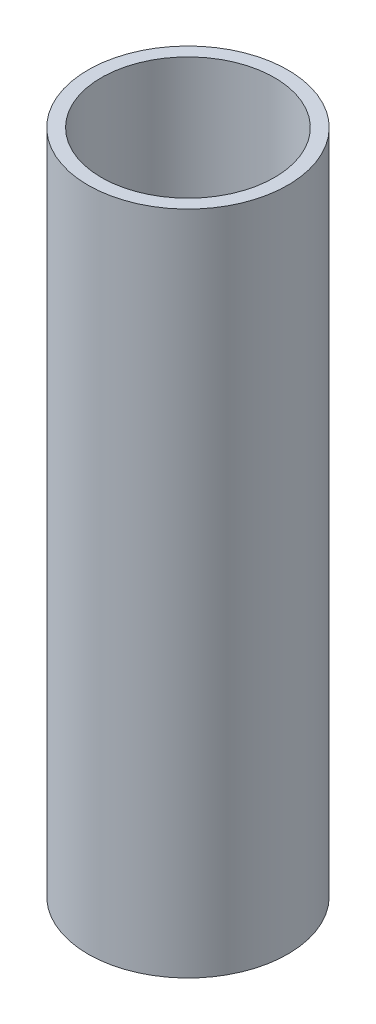
from build123d import *

# Parameters (mm, degrees)
SKETCH2_R           = 15
SKETCH2_R_2         = 13
BOSS_EXTRUDE1_DEPTH = 100


with BuildPart() as part:
    # Sketch2 → Boss-Extrude1 (new body)
    with BuildSketch(Plane(origin=(0, 0, 0), x_dir=(1, 0, 0), z_dir=(0, 1, 0))):
        with Locations(Location((0, 0, 0), (0, 0, 270))):
            Circle(SKETCH2_R)
        with Locations(Location((0, 0, 0), (0, 0, 270))):
            Circle(SKETCH2_R_2, mode=Mode.SUBTRACT)
    extrude(amount=BOSS_EXTRUDE1_DEPTH)


solid = part.part
